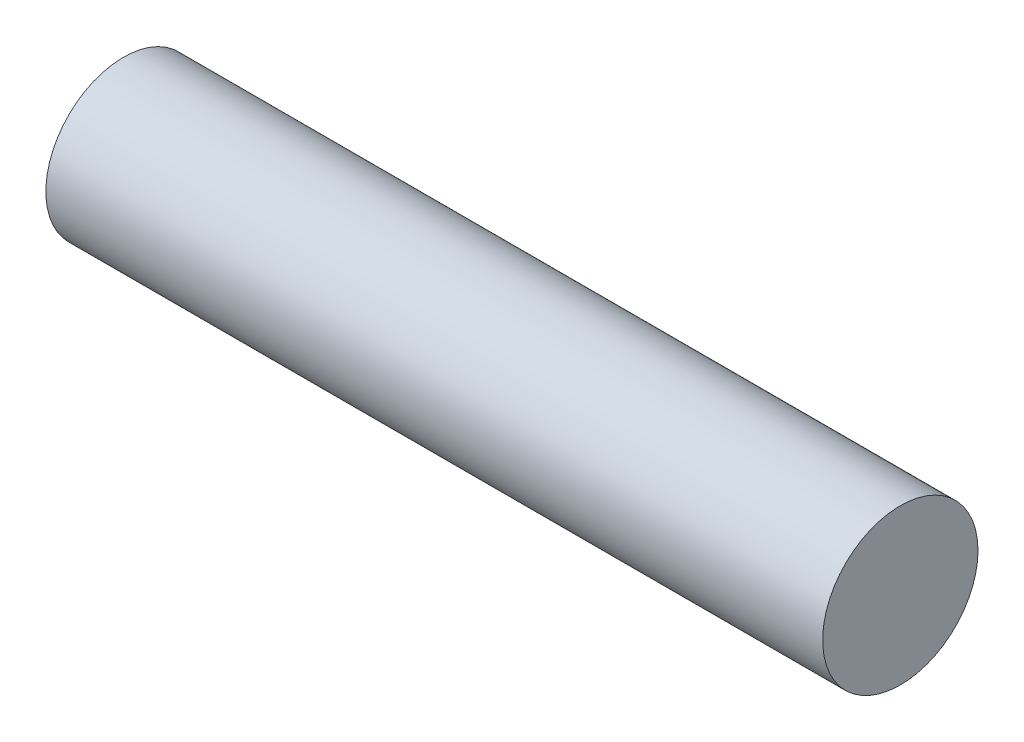
from build123d import *

# Parameters (mm, degrees)
ESQUISSE1_R        = 15
BOSS_EXTRU_1_DEPTH = 150


with BuildPart() as part:
    # Esquisse1 → Boss.-Extru.1 (new body)
    with BuildSketch(Plane(origin=(0, 0, 0), x_dir=(0, 0, -1), z_dir=(1, 0, 0))):
        Circle(ESQUISSE1_R)
    extrude(amount=BOSS_EXTRU_1_DEPTH)


solid = part.part
